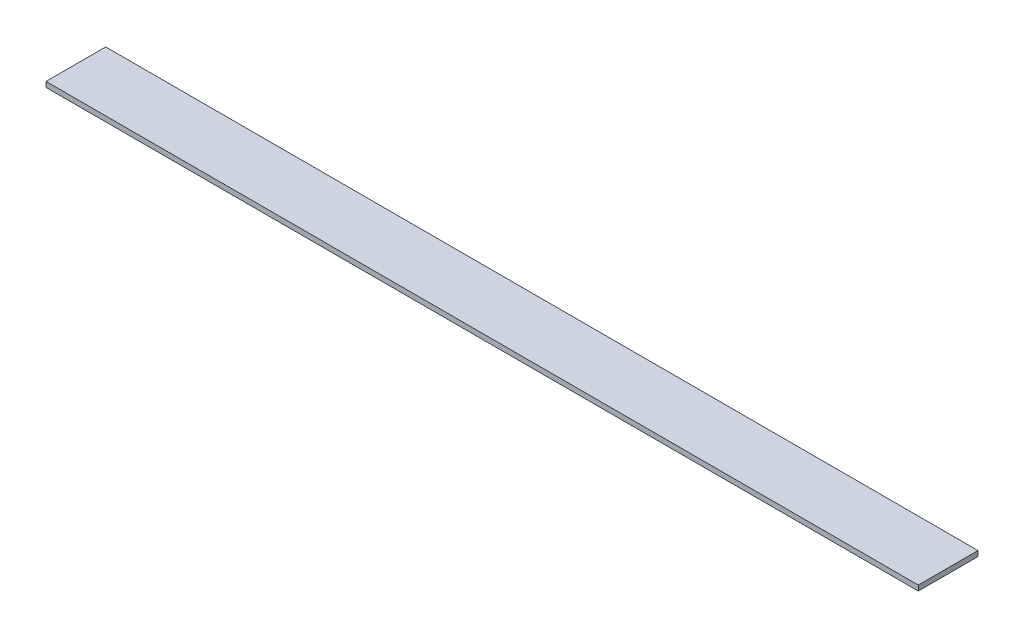
from build123d import *

# Parameters (mm, degrees)
SKETCH1_W           = 263
SKETCH1_H           = 18
BOSS_EXTRUDE1_DEPTH = 1.5748


with BuildPart() as part:
    # Sketch1 → Boss-Extrude1 (new body)
    with BuildSketch(Plane(origin=(0, 0, 0), x_dir=(1, 0, 0), z_dir=(0, 1, 0))):
        with Locations((101.732309173, -0.856406513)):
            Rectangle(SKETCH1_W, SKETCH1_H)
    extrude(amount=BOSS_EXTRUDE1_DEPTH)


solid = part.part
